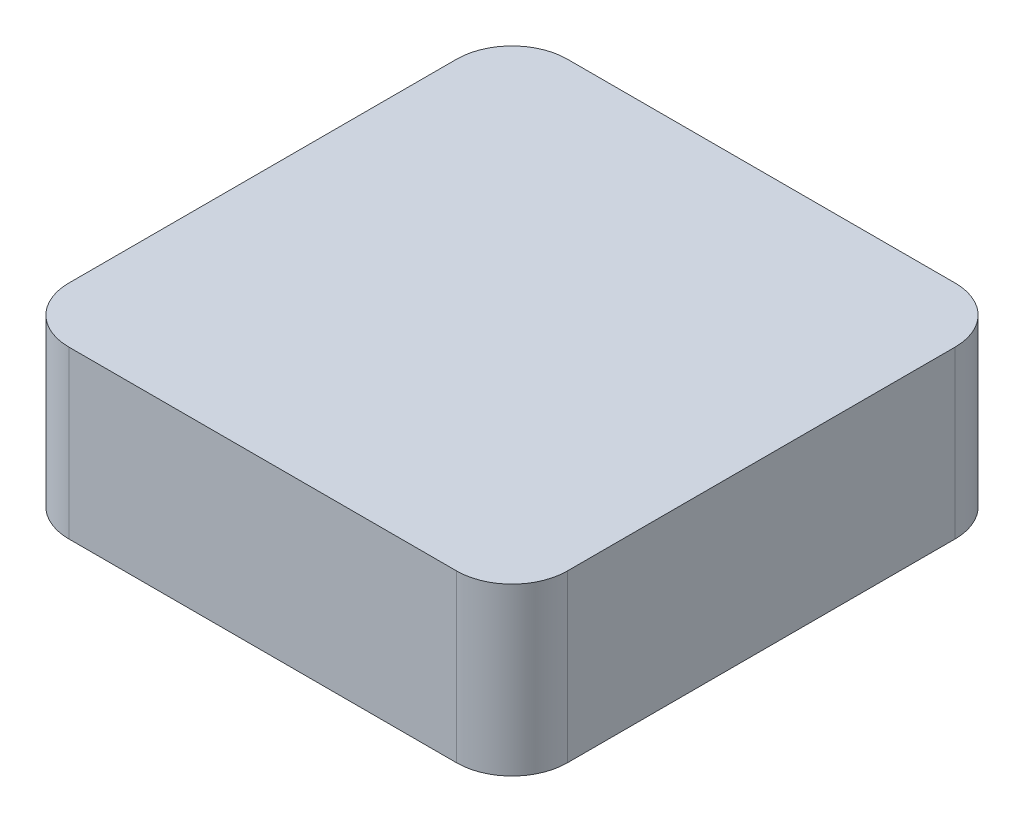
from build123d import *

# Parameters (mm, degrees)
SKETCH1_W           = 18
SKETCH1_H           = 18
BOSS_EXTRUDE1_DEPTH = 6
SKETCH2_W           = 14
SKETCH2_H           = 14
CUT_EXTRUDE1_DEPTH  = 4
CUT_EXTRUDE1_DRAFT  = -20
SKETCH3_R           = 3
BOSS_EXTRUDE2_DEPTH = 4
FILLET1_R           = 2


with BuildPart() as part:
    # Sketch1 → Boss-Extrude1 (new body)
    with BuildSketch(Plane(origin=(0, 0, 0), x_dir=(1, 0, 0), z_dir=(0, 1, 0))):
        with Locations((0.556064073, -1.915331808)):
            Rectangle(SKETCH1_W, SKETCH1_H)
    extrude(amount=BOSS_EXTRUDE1_DEPTH)


with BuildPart() as cut_extrude1_tool:
    # Sketch2 → Cut-Extrude1 (with draft: the straight prism first)
    with BuildSketch(Plane.XZ):
        with Locations((0.556064073, 1.915331808)):
            Rectangle(SKETCH2_W, SKETCH2_H)
    extrude(amount=-CUT_EXTRUDE1_DEPTH)
    # Cut-Extrude1: the draft: its side faces are tilted about the plane it starts from
    cut_extrude1_sides = [cut_extrude1_tool.faces().sort_by_distance(p)[0] for p in [
        (-6.443935927, 2, 1.915331808),
        (0.556064073, 2, -5.084668192),
        (7.556064073, 2, 1.915331808),
        (0.556064073, 2, 8.915331808),
    ]]
    draft(cut_extrude1_sides, Plane.XZ, CUT_EXTRUDE1_DRAFT)


with BuildPart() as part_1:
    add(part.part)

    # Cut-Extrude1: cut by cut_extrude1_tool
    add(cut_extrude1_tool.part, mode=Mode.SUBTRACT)

    # Sketch3 → Boss-Extrude2 (add)
    with BuildSketch(Plane.XZ.offset(-4)):
        with Locations(Location((0.556064073, 1.915331808, 0), (0, 0, 270))):
            Circle(SKETCH3_R)
        Polygon((-0.118935927, 1.240331808), (-1.468935927, 1.240331808), (-1.468935927, 2.590331808), (-0.118935927, 2.590331808), (-0.118935927, 3.940331808), (1.231064073, 3.940331808), (1.231064073, 2.590331808), (2.581064073, 2.590331808), (2.581064073, 1.240331808), (1.231064073, 1.240331808), (1.231064073, -0.109668192), (-0.118935927, -0.109668192), align=None, mode=Mode.SUBTRACT)
    extrude(amount=BOSS_EXTRUDE2_DEPTH)

    # Fillet1
    fillet1_edges = [part_1.edges().sort_by_distance(p)[0] for p in [
        (-8.443935927, 3, -7.084668192),
        (9.556064073, 3, -7.084668192),
        (9.556064073, 3, 10.915331808),
        (-8.443935927, 3, 10.915331808),
    ]]
    fillet(fillet1_edges, radius=FILLET1_R)


solid = part_1.part
